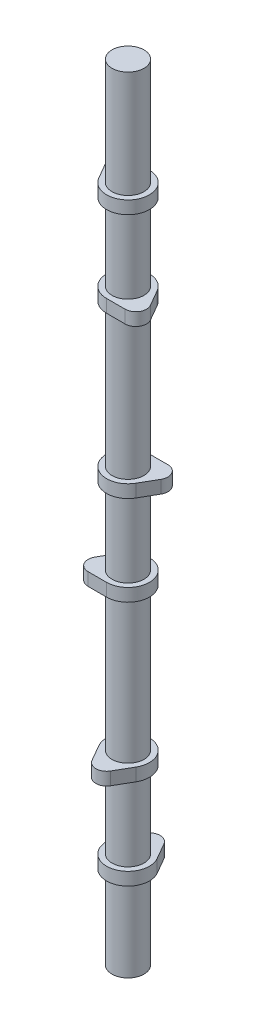
from build123d import *

# Parameters (mm, degrees)
BOSS_EXTRUDE1_DEPTH   = 7.62
LPATTERN2_COUNT       = 2
LPATTERN2_PITCH       = 53.34
BODY_MOVE_COPY1_ANGLE = 180
LPATTERN3_COUNT       = 3
LPATTERN3_PITCH       = 146.05
BODY_MOVE_COPY2_ANGLE = 120
BODY_MOVE_COPY3_ANGLE = 120
BOSS_EXTRUDE2_START   = -49.53
SKETCH4_R             = 9.5
BOSS_EXTRUDE2_DEPTH   = 466.09


with BuildPart() as part:
    # Sketch3 → Boss-Extrude1 (new body)
    with BuildSketch(Plane(origin=(0, 0, 0), x_dir=(1, 0, 0), z_dir=(0, 1, 0))):
        with BuildLine():
            Line((-5.499261314, 15.875), (-10.998522628, 6.35))
            ThreePointArc((-10.998522628, 6.35), (0, -12.7), (10.998522628, 6.35))
            Line((10.998522628, 6.35), (5.499261314, 15.875))
            ThreePointArc((5.499261314, 15.875), (0, 19.05), (-5.499261314, 15.875))
        make_face()
    extrude(amount=BOSS_EXTRUDE1_DEPTH)


with BuildPart() as lpattern2_1:
    # LPattern2: pattern copy
    add(part.part.moved(Location(Vector(0, 1, 0) * (1 * LPATTERN2_PITCH))))


with BuildPart() as lpattern2_1_1:
    # Body-Move/Copy1: moved
    add(lpattern2_1.part.rotate(Axis((0, 0, 0), (0, 1, 0)), BODY_MOVE_COPY1_ANGLE))


with BuildPart() as lpattern3_1:
    # LPattern3: pattern copy
    add(part.part.moved(Location(Vector(0, 1, 0) * (1 * LPATTERN3_PITCH))))


with BuildPart() as lpattern3_2:
    # LPattern3: pattern copy
    add(part.part.moved(Location(Vector(0, 1, 0) * (2 * LPATTERN3_PITCH))))


with BuildPart() as lpattern3_3:
    # LPattern3: pattern copy
    add(lpattern2_1_1.part.moved(Location(Vector(0, 1, 0) * (1 * LPATTERN3_PITCH))))


with BuildPart() as lpattern3_4:
    # LPattern3: pattern copy
    add(lpattern2_1_1.part.moved(Location(Vector(0, 1, 0) * (2 * LPATTERN3_PITCH))))


with BuildPart() as lpattern3_1_1:
    # Body-Move/Copy2: moved
    add(lpattern3_1.part.rotate(Axis((0, 0, 0), (0, 1, 0)), BODY_MOVE_COPY2_ANGLE))


with BuildPart() as lpattern3_3_1:
    # Body-Move/Copy2: moved
    add(lpattern3_3.part.rotate(Axis((0, 0, 0), (0, 1, 0)), BODY_MOVE_COPY2_ANGLE))


with BuildPart() as lpattern3_4_1:
    # Body-Move/Copy3: moved
    add(lpattern3_4.part.rotate(Axis((0, 0, 0), (0, -1, 0)), BODY_MOVE_COPY3_ANGLE))


with BuildPart() as lpattern3_2_1:
    # Body-Move/Copy3: moved
    add(lpattern3_2.part.rotate(Axis((0, 0, 0), (0, -1, 0)), BODY_MOVE_COPY3_ANGLE))


with BuildPart() as part_1:
    add(part.part)

    add(lpattern2_1_1.part)  # Boss-Extrude2 merges LPattern2_1

    add(lpattern3_1_1.part)  # Boss-Extrude2 merges LPattern3_1

    add(lpattern3_2_1.part)  # Boss-Extrude2 merges LPattern3_2

    add(lpattern3_3_1.part)  # Boss-Extrude2 merges LPattern3_3

    add(lpattern3_4_1.part)  # Boss-Extrude2 merges LPattern3_4
    # Sketch4 → Boss-Extrude2 (add)
    with BuildSketch(Plane(origin=(0, 0, 0), x_dir=(1, 0, 0), z_dir=(0, 1, 0)).offset(BOSS_EXTRUDE2_START)):
        Circle(SKETCH4_R)
    extrude(amount=BOSS_EXTRUDE2_DEPTH)


solid = part_1.part
